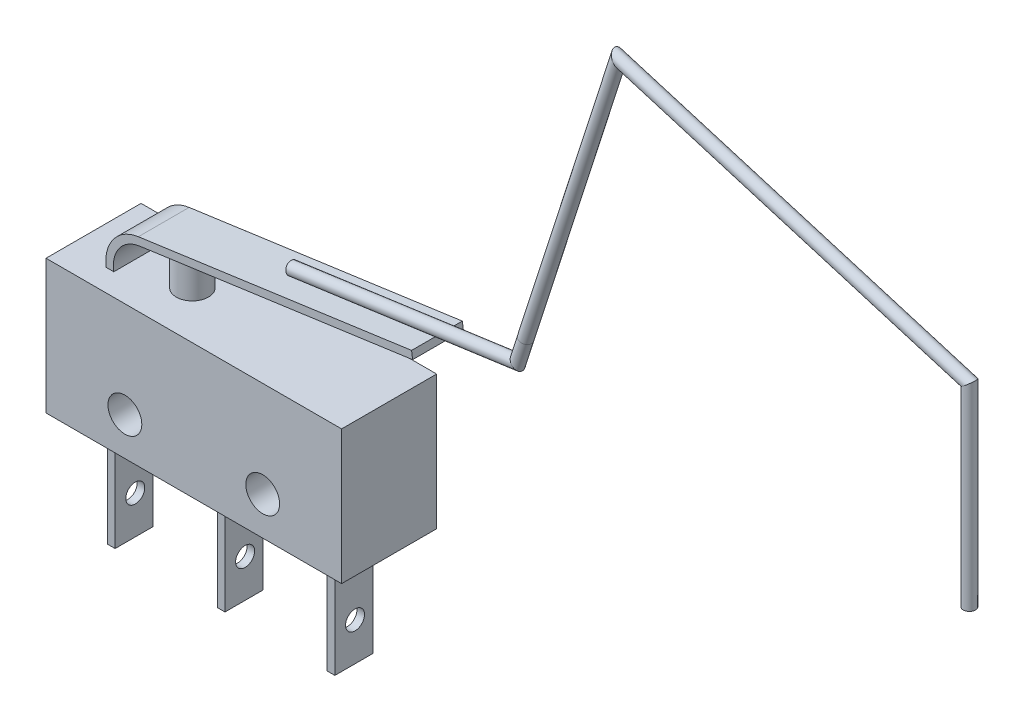
from build123d import *

# Parameters (mm, degrees)
SKETCH1_W           = 19.7485
SKETCH1_H           = 8.9535
SKETCH1_R           = 1.1303
BOSS_EXTRUDE1_DEPTH = 3.175
SKETCH2_W           = 0.508
SKETCH2_H           = 7.366
BOSS_EXTRUDE2_DEPTH = 2.54
SKETCH3_R           = 0.635
CUT_EXTRUDE1_DEPTH  = 22.342260257
BOSS_EXTRUDE3_DEPTH = 1.69545
BOSS_EXTRUDE4_REACH = 23.191
SKETCH5_R           = 1.07315
SKETCH7_R           = 0.4064


with BuildPart() as part:
    # Sketch1 → Boss-Extrude1 (new, symmetric)
    with BuildSketch(Plane.XY):
        Rectangle(SKETCH1_W, SKETCH1_H)
        with Locations((-4.60375, -1.93675)):
            Circle(SKETCH1_R, mode=Mode.SUBTRACT)
        with Locations((4.60375, -1.93675)):
            Circle(SKETCH1_R, mode=Mode.SUBTRACT)
    extrude(amount=BOSS_EXTRUDE1_DEPTH, both=True)

    # Sketch2 → Boss-Extrude2 (add)
    with BuildSketch(Plane.XY.offset(1.3462)):
        with Locations((-7.3406, -8.15975)):
            Rectangle(SKETCH2_W, SKETCH2_H)
        with Locations((0, -8.15975)):
            Rectangle(SKETCH2_W, SKETCH2_H)
        with Locations((7.3406, -8.15975)):
            Rectangle(SKETCH2_W, SKETCH2_H)
    extrude(amount=-BOSS_EXTRUDE2_DEPTH)

    # Sketch3 → Cut-Extrude1 (cut, through all)
    with BuildSketch(Plane.ZY.offset(7.5946)):
        with Locations(Location((0, -9.30275, 0), (0, 0, 270))):
            Circle(SKETCH3_R)
    extrude(amount=-CUT_EXTRUDE1_DEPTH, mode=Mode.SUBTRACT)

    # Sketch4 → Boss-Extrude3 (add, symmetric)
    with BuildSketch(Plane.XY):
        with BuildLine():
            Line((-5.181756672, 7.328171185), (13.069818987, 9.877482256))
            Line((13.069818987, 9.877482256), (13.140092321, 9.374366307))
            Line((13.140092321, 9.374366307), (-5.107440727, 6.825619892))
            ThreePointArc((-5.107440727, 6.825619892), (-6.463591279, 6.014683788), (-6.82625, 4.47675))
            Line((-6.82625, 4.47675), (-7.33425, 4.47675))
            ThreePointArc((-7.33425, 4.47675), (-6.848552, 6.348256557), (-5.181756672, 7.328171185))
        make_face()
    extrude(amount=BOSS_EXTRUDE3_DEPTH, both=True)

    # Boss-Extrude4: up to this plane
    boss_extrude4_end = Plane(origin=(13.140092321, 9.374366307, 1.69545), z_dir=(-0.13833333333333328, 0.9903857273249089, 0))
    # Sketch5 → Boss-Extrude4 (add, up to the surface)
    with BuildSketch(Plane(origin=(0, 4.47675, 0), x_dir=(1, 0, 0), z_dir=(0, 1, 0)), mode=Mode.PRIVATE) as boss_extrude4_sk1:
        with Locations(Location((-3.27025, 0, 0), (0, 0, 90))):
            Circle(SKETCH5_R)
    boss_extrude4_tool1 = split(extrude(boss_extrude4_sk1.sketch, amount=BOSS_EXTRUDE4_REACH, mode=Mode.PRIVATE), bisect_by=boss_extrude4_end, keep=Keep.BOTH, mode=Mode.PRIVATE)
    add(boss_extrude4_tool1.solids().sort_by_distance((-3.27025, 4.47675, 0))[0])


with BuildPart() as body_2:
    # Sweep1: sweep along a path in Sketch6
    with BuildLine(Plane.XY) as sweep1_path:
        Line((48.641, 11.99515), (48.641, 24.96185))
        Line((48.641, 24.96185), (25.2095, 32.01035))
        Line((25.2095, 32.01035), (18.9992, 12.70635))
        Line((18.9992, 12.70635), (18.472141645, 11.06805))
        Line((18.472141645, 11.06805), (3.37866316, 8.95985))
    # Sketch7 → Sweep1 (sweep)
    with BuildSketch(Plane(origin=(4.541538232, 0.634344887, 0), x_dir=(0, 0, -1), z_dir=(0.9903857273249097, 0.13833333333332826, 0))):
        with Locations((0, 8.406325822)):
            Circle(SKETCH7_R)
    sweep(path=sweep1_path.line, transition=Transition.RIGHT)


solid = Compound([part.part, body_2.part])
